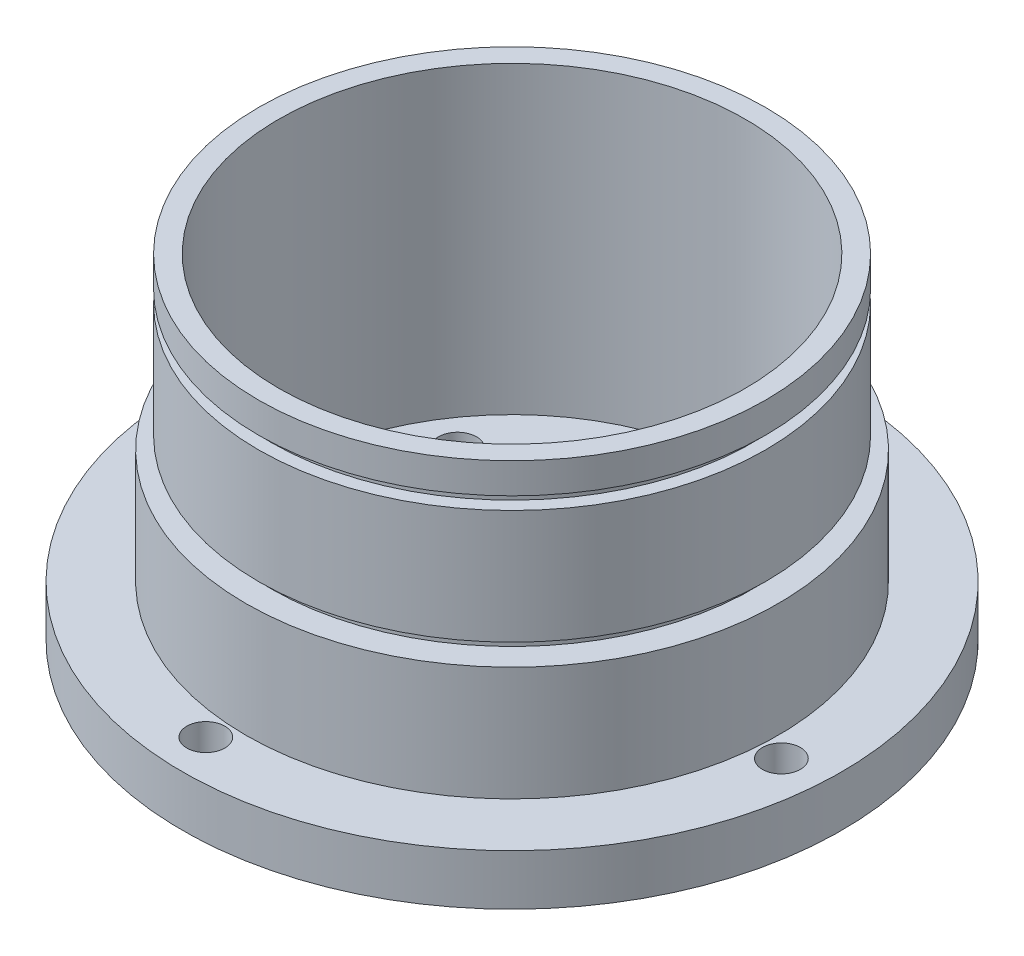
from build123d import *

# Parameters (mm, degrees)
SKETCH_1_R           = 21
EXTRUDE_2_DEPTH      = 26.4
SKETCH_10_R          = 18.4
CUT_EXTRUDE_5_DEPTH  = 24
SKETCH_11_R          = 1.5
CUT_EXTRUDE_6_DEPTH  = 24
EXTRUDE_START        = 4
SKETCH_13_R          = 24.5
SKETCH_13_R_2        = 21
EXTRUDE_4_DEPTH      = 4
SKETCH_14_R          = 1.5
CUT_EXTRUDE_7_DEPTH  = 4
SKETCH_16_R          = 21
SKETCH_16_R_2        = 19
CUT_EXTRUDE_10_DEPTH = 1
SKETCH_27_R          = 21
SKETCH_27_R_2        = 20
CUT_EXTRUDE_14_DEPTH = 20
SKETCH_29_R          = 20
SKETCH_29_R_2        = 19
CUT_EXTRUDE_15_DEPTH = 1
CUT_EXTRUDE_16_DEPTH = 10
SKETCH_32_R          = 26
SKETCH_32_R_2        = 24.5
EXTRUDE_5_DEPTH      = 4


with BuildPart() as part:
    # 草图1 → 凸台-拉伸2 (new body)
    with BuildSketch(Plane(origin=(0, 0, 0), x_dir=(1, 0, 0), z_dir=(0, 1, 0))):
        with Locations(Location((0, 0, 0), (0, 0, 270))):
            Circle(SKETCH_1_R)
    extrude(amount=EXTRUDE_2_DEPTH)

    # 草图10 → 切除-拉伸5 (cut)
    with BuildSketch(Plane(origin=(0, 26.4, 0), x_dir=(1, 0, 0), z_dir=(0, 1, 0))):
        with Locations(Location((0, 0, 0), (0, 0, 270))):
            Circle(SKETCH_10_R)
    extrude(amount=-CUT_EXTRUDE_5_DEPTH, mode=Mode.SUBTRACT)

    # 草图11 → 切除-拉伸6 (cut)
    with BuildSketch(Plane.XZ):
        with Locations(Location((-0.993017559, 15.468158136, 0), (0, 0, 270))):
            Circle(SKETCH_11_R)
        with Locations(Location((12.899309116, 8.594057501, 0), (0, 0, 270))):
            Circle(SKETCH_11_R)
        with Locations(Location((13.892326675, -6.874100635, 0), (0, 0, 270))):
            Circle(SKETCH_11_R)
        with Locations(Location((0.993017559, -15.468158136, 0), (0, 0, 270))):
            Circle(SKETCH_11_R)
        with Locations(Location((-12.899309116, -8.594057501, 0), (0, 0, 270))):
            Circle(SKETCH_11_R)
        with Locations(Location((-13.892326675, 6.874100635, 0), (0, 0, 270))):
            Circle(SKETCH_11_R)
    extrude(amount=-CUT_EXTRUDE_6_DEPTH, mode=Mode.SUBTRACT)

    # 草图13 → 凸台-拉伸4 (add)
    with BuildSketch(Plane(origin=(0, 4, 0), x_dir=(-1, 0, 0), z_dir=(0, -1, 0)).offset(EXTRUDE_START)):
        with Locations(Location((0, 0, 0), (0, 0, 90))):
            Circle(SKETCH_13_R)
        with Locations(Location((0, 0, 0), (0, 0, 90))):
            Circle(SKETCH_13_R_2, mode=Mode.SUBTRACT)
    extrude(amount=-EXTRUDE_4_DEPTH)

    # 草图14 → 切除-拉伸7 (cut)
    with BuildSketch(Plane(origin=(0, 4, 0), x_dir=(1, 0, 0), z_dir=(0, 1, 0))):
        with Locations(Location((1.457493515, 22.703264361, 0), (0, 0, 270))):
            Circle(SKETCH_14_R)
        with Locations(Location((22.703264361, -1.457493515, 0), (0, 0, 270))):
            Circle(SKETCH_14_R)
        with Locations(Location((-1.457493515, -22.703264361, 0), (0, 0, 270))):
            Circle(SKETCH_14_R)
        with Locations(Location((-22.703264361, 1.457493515, 0), (0, 0, 270))):
            Circle(SKETCH_14_R)
    extrude(amount=-CUT_EXTRUDE_7_DEPTH, mode=Mode.SUBTRACT)

    # 草图16 → 切除-拉伸10 (cut)
    with BuildSketch(Plane(origin=(0, 13, 0), x_dir=(-1, 0, 0), z_dir=(0, -1, 0))):
        with Locations(Location((0, 0, 0), (0, 0, 90))):
            Circle(SKETCH_16_R)
        with Locations(Location((0, 0, 0), (0, 0, 90))):
            Circle(SKETCH_16_R_2, mode=Mode.SUBTRACT)
    extrude(amount=-CUT_EXTRUDE_10_DEPTH, mode=Mode.SUBTRACT)

    # 草图27 → 切除-拉伸14 (cut)
    with BuildSketch(Plane.XZ.offset(-14)):
        with Locations(Location((0, 0, 0), (0, 0, 270))):
            Circle(SKETCH_27_R)
        with Locations(Location((0, 0, 0), (0, 0, 270))):
            Circle(SKETCH_27_R_2, mode=Mode.SUBTRACT)
    extrude(amount=-CUT_EXTRUDE_14_DEPTH, mode=Mode.SUBTRACT)

    # 草图29 → 切除-拉伸15 (cut)
    with BuildSketch(Plane(origin=(0, 23, 0), x_dir=(-1, 0, 0), z_dir=(0, -1, 0))):
        with Locations(Location((0, 0, 0), (0, 0, 90))):
            Circle(SKETCH_29_R)
        with Locations(Location((0, 0, 0), (0, 0, 90))):
            Circle(SKETCH_29_R_2, mode=Mode.SUBTRACT)
    extrude(amount=-CUT_EXTRUDE_15_DEPTH, mode=Mode.SUBTRACT)

    # 草图31 → 切除-拉伸16 (cut)
    with BuildSketch(Plane.XZ):
        with BuildLine():
            Line((7, -6.018809273), (-6.401397723, -6.018809273))
            ThreePointArc((-6.401397723, -6.018809273), (-12.420206996, 0), (-6.401397723, 6.018809273))
            Line((-6.401397723, 6.018809273), (7, 6.018809273))
            ThreePointArc((7, 6.018809273), (13.018809273, 0), (7, -6.018809273))
        make_face()
    extrude(amount=-CUT_EXTRUDE_16_DEPTH, mode=Mode.SUBTRACT)

    # 草图32 → 凸台-拉伸5 (add)
    with BuildSketch(Plane.XZ):
        with Locations(Location((0, 0, 0), (0, 0, 270))):
            Circle(SKETCH_32_R)
        Circle(SKETCH_32_R_2, mode=Mode.SUBTRACT)
    extrude(amount=-EXTRUDE_5_DEPTH)


solid = part.part
